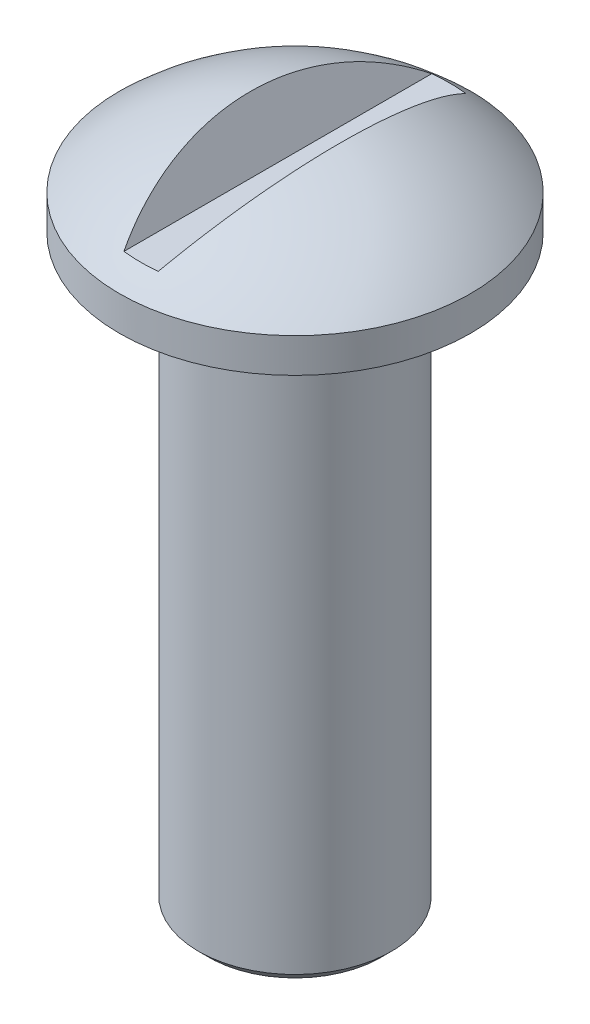
from build123d import *

# Parameters (mm, degrees)
SKETCH4_W          = 2.54
SKETCH4_H          = 27.171217738
CUT_EXTRUDE1_DEPTH = 51.433553315
CUT_EXTRUDE1_TAPER = -30


with BuildPart() as part:
    # Sketch2 → Revolve3 (revolve)
    with BuildSketch(Plane.XY, mode=Mode.PRIVATE) as revolve3_sk:
        with BuildLine():
            Line((-6.35, 0), (-7.112, 0.762))
            Line((-7.112, 0.762), (-7.112, 43.18))
            Line((-7.112, 43.18), (-12.951509565, 43.18))
            Line((-12.951509565, 43.18), (-12.951509565, 45.72))
            ThreePointArc((-12.951509565, 45.72), (-6.95607648, 49.484584856), (0, 50.8))
            Line((0, 50.8), (0, 0))
            Line((0, 0), (-6.35, 0))
        make_face()
    revolve(revolve3_sk.sketch.rotate(Axis((0, -6.534819654, 0), (0, 1, 0)), 270), axis=Axis((0, -6.534819654, 0), (0, 1, 0)))

    # Sketch4 → Cut-Extrude1 (cut, through all)
    with BuildSketch(Plane(origin=(0, 46.99, 0), x_dir=(1, 0, 0), z_dir=(0, 1, 0))):
        Rectangle(SKETCH4_W, SKETCH4_H)
    extrude(amount=CUT_EXTRUDE1_DEPTH, taper=CUT_EXTRUDE1_TAPER, mode=Mode.SUBTRACT)


solid = part.part
